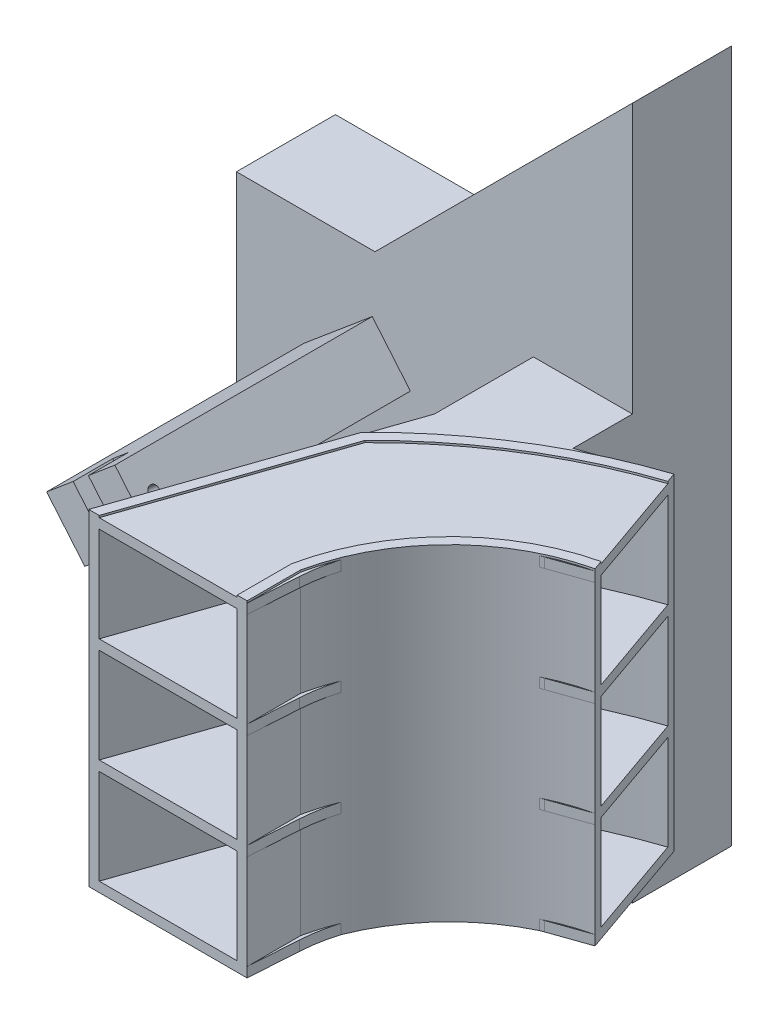
from build123d import *

# Parameters (mm, degrees)
P_IDAT_VYSUNUT_M1_DEPTH  = 50
SKICA7_W                 = 50
SKICA7_H                 = 164
P_IDAT_VYSUNUT_M5_DEPTH  = 30
P_IDAT_VYSUNUT_M16_DEPTH = 5
LINPOLE1_COUNT           = 4
LINPOLE1_PITCH           = 53
P_IDAT_VYSUNUT_M17_DEPTH = 55
LINPOLE2_COUNT           = 3
LINPOLE2_PITCH           = 55
P_IDAT_VYSUNUT_M18_DEPTH = 110
P_IDAT_VYSUNUT_M19_DEPTH = 20
SKICA29_R                = 2.5
ODEBRAT_VYSUNUT_M1_DEPTH = 387.276474167


with BuildPart() as part:
    # Skica1 → Přidat vysunutím1 (new body)
    with BuildSketch(Plane.XY):
        Polygon((0, 0), (200, 0), (200, 350), (70, 220), (0, 220), align=None)
    extrude(amount=P_IDAT_VYSUNUT_M1_DEPTH)

    # Skica7 → Přidat vysunutím5 (add)
    with BuildSketch(Plane.XY.offset(50)):
        with Locations((175, 132)):
            Rectangle(SKICA7_W, SKICA7_H)
    extrude(amount=P_IDAT_VYSUNUT_M5_DEPTH)

    # Skica23 → Přidat vysunutím16 (add)
    with BuildSketch(Plane.XZ.offset(-50)):
        with BuildLine():
            Line((200, 80), (237.75041097, 66.774778957))
            Line((237.75041097, 66.774778957), (259.241395164, 128.119196783))
            Line((259.241395164, 128.119196783), (240.366189679, 134.731807304))
            ThreePointArc((240.366189679, 134.731807304), (203.062547088, 161.906480142), (186.977305802, 205.164885189))
            Line((186.977305802, 205.164885189), (185.40091467, 230))
            Line((185.40091467, 230), (105.40091467, 230))
            Line((105.40091467, 230), (150, 100))
            Line((150, 100), (150, 80))
            Line((150, 80), (200, 80))
        make_face()
    p_idat_vysunut_m16 = extrude(amount=-P_IDAT_VYSUNUT_M16_DEPTH)

    # LinPole1: Přidat vysunutím16 ×4
    with Locations(*[(0, i * LINPOLE1_PITCH, 0) for i in range(1, LINPOLE1_COUNT)]):
        add(p_idat_vysunut_m16)

    # Skica26 → Přidat vysunutím17 (add)
    with BuildSketch(Plane.XZ.offset(-50)):
        with BuildLine():
            Line((140.606634732, 127.380325757), (105.40091467, 230))
            Line((105.40091467, 230), (110.686974043, 230))
            Line((110.686974043, 230), (144.970270535, 130.069059465))
            ThreePointArc((144.970270535, 130.069059465), (188.679692745, 95.127098247), (239.4035636, 71.493580328))
            Line((239.4035636, 71.493580328), (237.75041097, 66.774778957))
            ThreePointArc((237.75041097, 66.774778957), (185.516396292, 91.207581344), (140.606634732, 127.380325757))
        make_face()
        with BuildLine():
            Line((185.40091467, 230), (185.40091467, 202.92837758))
            ThreePointArc((185.40091467, 202.92837758), (211.446760209, 154.790204461), (259.241395164, 128.119196783))
            Line((259.241395164, 128.119196783), (257.588242534, 123.400395411))
            ThreePointArc((257.588242534, 123.400395411), (207.477117523, 151.738564679), (180.40091467, 202.542658277))
            Line((180.40091467, 202.542658277), (180.40091467, 230))
            Line((180.40091467, 230), (185.40091467, 230))
        make_face()
    p_idat_vysunut_m17 = extrude(amount=-P_IDAT_VYSUNUT_M17_DEPTH)

    # LinPole2: Přidat vysunutím17 ×3
    with Locations(*[(0, i * LINPOLE2_PITCH, 0) for i in range(1, LINPOLE2_COUNT)]):
        add(p_idat_vysunut_m17)

    # Skica27 → Přidat vysunutím18 (add)
    with BuildSketch(Plane.XY.offset(50)):
        Polygon((53.405814175, 139.046612135), (87.877814115, 167.972054571), (68.594185825, 190.953387865), (34.122185885, 162.027945429), align=None)
    extrude(amount=P_IDAT_VYSUNUT_M18_DEPTH)

    # Skica28 → Přidat vysunutím19 (add)
    with BuildSketch(Plane.XY.offset(160)):
        Polygon((55.18840807, 179.704604695), (74.472036361, 156.723271402), (87.877814115, 167.972054571), (68.594185825, 190.953387865), align=None)
        Polygon((47.527963639, 173.276728598), (66.81159193, 150.295395305), (53.405814175, 139.046612135), (34.122185885, 162.027945429), align=None)
    extrude(amount=P_IDAT_VYSUNUT_M19_DEPTH)

    # Skica29 → Odebrat vysunutím1 (cut, through all)
    with BuildSketch(Plane(origin=(99.806909072, 83.747940591, 0), x_dir=(0, 0, 1), z_dir=(-0.7660444431189739, -0.6427876096865444, 0))):
        with Locations(Location((170, 87.187288924, 0), (0, 0, 270))):
            Circle(SKICA29_R)
    extrude(amount=-ODEBRAT_VYSUNUT_M1_DEPTH, mode=Mode.SUBTRACT)


solid = part.part
